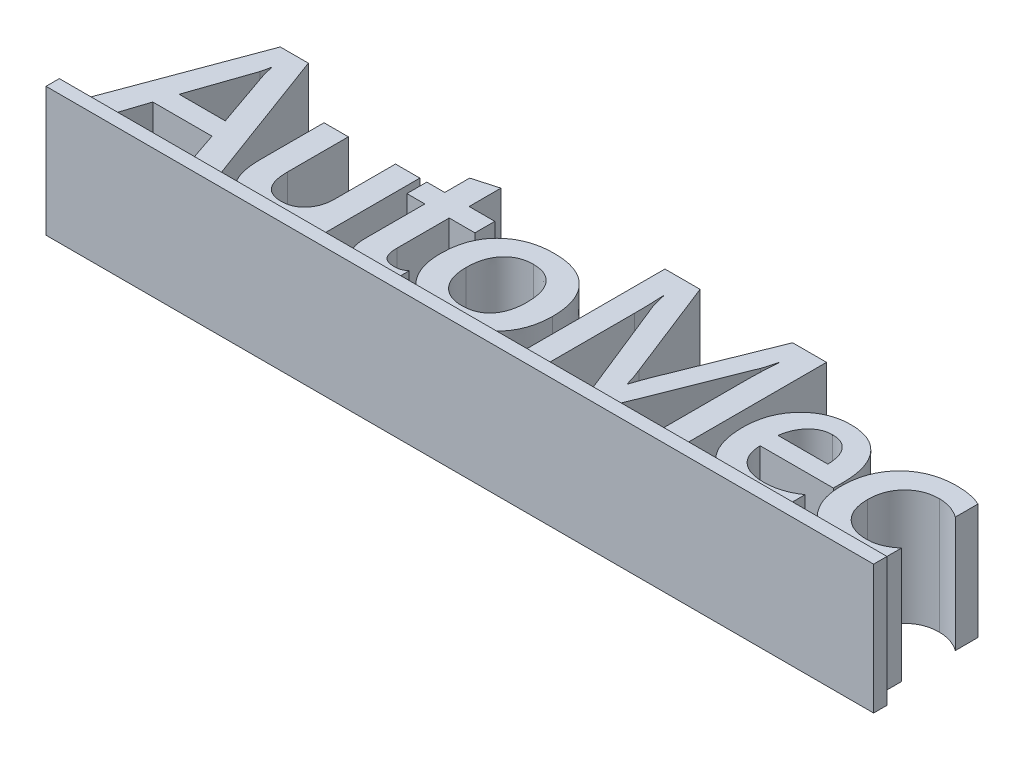
from build123d import *

# Parameters (mm, degrees)
BOSS_EXTRUDE3_DEPTH   = 26
BOSS_EXTRUDE3_2_DEPTH = 26
BOSS_EXTRUDE3_3_DEPTH = 26
BOSS_EXTRUDE3_4_DEPTH = 26
BOSS_EXTRUDE3_5_DEPTH = 26
BOSS_EXTRUDE3_6_DEPTH = 26
BOSS_EXTRUDE3_7_DEPTH = 26
SKETCH8_W             = 186.081167763
SKETCH8_H             = 3
BOSS_EXTRUDE6_DEPTH   = 29
SKETCH9_W             = 4.604295261
SKETCH9_H             = 4.075246711
BOSS_EXTRUDE7_DEPTH   = 26
SKETCH10_W            = 0.947185653
SKETCH10_H            = 0.391447368
BOSS_EXTRUDE8_DEPTH   = 26
SKETCH11_W            = 4.086731753
SKETCH11_H            = 1.558799342
BOSS_EXTRUDE9_DEPTH   = 26
SKETCH12_W            = 3.146388957
SKETCH12_H            = 1.300164474
BOSS_EXTRUDE10_DEPTH  = 26


with BuildPart() as part:
    # Sketch3 → Boss-Extrude3 (new body)
    with BuildSketch(Plane(origin=(0, 0, 0), x_dir=(1, 0, 0), z_dir=(0, 1, 0))):
        Polygon((33.965871711, 0), (27.807565789, 0), (24.766858553, 8.947368421), (11.457648026, 8.947368421), (8.535773026, 0), (2.3984375, 0), (15.071546053, 34), (21.390625, 34), align=None)
        with BuildLine():
            Line((23.277960526, 13.421052632), (18.587582237, 26.932976974))
            add(Edge.make_bspline(
                [(18.587582237, 26.932976974), (18.548101045, 27.060575153), (18.459275885, 27.347646749), (18.367014618, 27.839645061), (18.239400169, 28.423737496), (18.174856897, 28.850100474), (18.140213816, 29.078947368)],
                knots=[0, 0, 0, 0, 0.729984796, 1.642326725, 2.734537859, 4, 4, 4, 4], degree=3))
            Line((18.140213816, 29.078947368), (18.042351974, 29.078947368))
            add(Edge.make_bspline(
                [(18.042351974, 29.078947368), (18.009674078, 28.864165636), (17.947638546, 28.456425206), (17.825299172, 27.886844553), (17.710174952, 27.383968641), (17.617503708, 27.077025279), (17.574013158, 26.932976974)],
                knots=[0, 0, 0, 0, 1.185466323, 2.250482591, 3.1789527, 4, 4, 4, 4], degree=3))
            Line((17.574013158, 26.932976974), (12.925575658, 13.421052632))
            Line((12.925575658, 13.421052632), (23.277960526, 13.421052632))
        make_face(mode=Mode.SUBTRACT)
    extrude(amount=BOSS_EXTRUDE3_DEPTH)



with BuildPart() as body_2:
    # Sketch3 → Boss-Extrude3 2 (new body)
    with BuildSketch(Plane(origin=(0, 0, 0), x_dir=(1, 0, 0), z_dir=(0, 1, 0))):
        with BuildLine():
            Line((56.29375, 0), (50.820476974, 0))
            Line((50.820476974, 0), (50.820476974, 4.075246711))
            Line((50.820476974, 4.075246711), (50.722615132, 4.075246711))
            add(Edge.make_bspline(
                [(50.722615132, 4.075246711), (50.519935144, 3.715057326), (50.126604746, 3.016056721), (49.39560065, 2.091776269), (48.587459374, 1.308026839), (47.69578099, 0.659377738), (46.715132669, 0.162634197), (45.654651126, -0.197849774), (44.509830852, -0.409768991), (43.719402161, -0.434602531), (43.313075658, -0.447368421)],
                knots=[0, 0, 0, 0, 1.079725848, 2.095367192, 3.06949039, 4.016760712, 4.968041884, 5.93364341, 6.937772052, 8, 8, 8, 8], degree=3))
            add(Edge.make_bspline(
                [(43.313075658, -0.447368421), (42.967836418, -0.439355495), (42.296204328, -0.423767065), (41.323402019, -0.302248164), (40.411572364, -0.113138442), (39.573631593, 0.178861855), (38.794387817, 0.531364638), (38.090987822, 0.978782599), (37.447457228, 1.498940574), (36.873222706, 2.103701725), (36.3649034, 2.78825589), (35.932471092, 3.555200243), (35.568305349, 4.40217537), (35.27199471, 5.325304496), (35.030777604, 6.32693486), (34.868069359, 7.409734562), (34.770474627, 8.572757186), (34.757070793, 9.373567228), (34.750164474, 9.786184211)],
                knots=[0, 0, 0, 0, 1.084713073, 2.110212352, 3.076892847, 4.00554504, 4.893457195, 5.758981407, 6.617912711, 7.488102356, 8.372747002, 9.291062449, 10.248797554, 11.265446988, 12.334723834, 13.48333476, 14.703289464, 16, 16, 16, 16], degree=3))
            Line((34.750164474, 9.786184211), (34.750164474, 24.157894737))
            Line((34.750164474, 24.157894737), (40.2234375, 24.157894737))
            Line((40.2234375, 24.157894737), (40.2234375, 10.457236842))
            add(Edge.make_bspline(
                [(40.2234375, 10.457236842), (40.227921152, 10.198508998), (40.236656835, 9.694418861), (40.290824437, 8.963512292), (40.386108863, 8.283162461), (40.529108844, 7.655814879), (40.70017065, 7.074146206), (40.914933354, 6.540934251), (41.176398091, 6.062390631), (41.470789874, 5.633108204), (41.801388553, 5.247886169), (42.179550685, 4.920526462), (42.596762914, 4.64571346), (43.052420412, 4.41933377), (43.54412455, 4.239131733), (44.078642, 4.110713393), (44.651223063, 4.045456825), (45.046487399, 4.032807556), (45.249342105, 4.026315789)],
                knots=[0, 0, 0, 0, 1.33211556, 2.595415729, 3.771149648, 4.865479191, 5.905389678, 6.890066322, 7.81878141, 8.707263502, 9.566093683, 10.424923863, 11.273385492, 12.131796628, 13.038874263, 13.964173805, 14.955187992, 16, 16, 16, 16], degree=3))
            add(Edge.make_bspline(
                [(45.249342105, 4.026315789), (45.447702282, 4.031443284), (45.836939898, 4.04150485), (46.40863582, 4.128206474), (46.951484922, 4.267498611), (47.471948728, 4.456495826), (47.957649198, 4.709484046), (48.421276691, 5.013940546), (48.851224373, 5.379136943), (49.257586842, 5.791759516), (49.6275201, 6.247945191), (49.939226546, 6.750076446), (50.217875081, 7.277381295), (50.440348446, 7.842328422), (50.606200553, 8.445473657), (50.734490971, 9.077862697), (50.801381432, 9.747490403), (50.814013736, 10.203137507), (50.820476974, 10.436266447)],
                knots=[0, 0, 0, 0, 0.999150715, 1.960610493, 2.906092422, 3.819987555, 4.744233245, 5.659334442, 6.60947108, 7.580916613, 8.57481006, 9.561813227, 10.554388006, 11.576996797, 12.614063925, 13.703262757, 14.824889011, 16, 16, 16, 16], degree=3))
            Line((50.820476974, 10.436266447), (50.820476974, 24.157894737))
            Line((50.820476974, 24.157894737), (56.29375, 24.157894737))
            Line((56.29375, 24.157894737), (56.29375, 0))
        make_face()
    extrude(amount=BOSS_EXTRUDE3_2_DEPTH)


with BuildPart() as body_3:
    # Sketch3 → Boss-Extrude3 3 (new body)
    with BuildSketch(Plane(origin=(0, 0, 0), x_dir=(1, 0, 0), z_dir=(0, 1, 0))):
        with BuildLine():
            add(Edge.make_bspline(
                [(73.148355263, 0.391447368), (72.862441983, 0.262212261), (72.266015813, -0.007377176), (71.261962299, -0.266704273), (70.135503638, -0.415010239), (69.341561845, -0.436256328), (68.926315789, -0.447368421)],
                knots=[0, 0, 0, 0, 0.865864127, 1.80622609, 2.852616184, 4, 4, 4, 4], degree=3))
            add(Edge.make_bspline(
                [(68.926315789, -0.447368421), (68.641827941, -0.441976485), (68.090415955, -0.431525501), (67.292069444, -0.351932158), (66.545705264, -0.234353409), (65.859662174, -0.037245325), (65.219587354, 0.183975911), (64.642293108, 0.478393413), (64.112458994, 0.808620086), (63.648826887, 1.208441395), (63.231335916, 1.651644998), (62.867107897, 2.147747278), (62.563427287, 2.700673489), (62.324499579, 3.303888027), (62.120319749, 3.953780656), (61.997422062, 4.661163859), (61.908208741, 5.417414181), (61.89898653, 5.938985548), (61.894243421, 6.207236842)],
                knots=[0, 0, 0, 0, 1.229298507, 2.382702577, 3.465489837, 4.48920099, 5.464042504, 6.387321762, 7.284075982, 8.155768071, 9.025013382, 9.911301508, 10.808281896, 11.743349568, 12.711823935, 13.746816671, 14.84115697, 16, 16, 16, 16], degree=3))
            Line((61.894243421, 6.207236842), (61.894243421, 19.684210526))
            Line((61.894243421, 19.684210526), (57.8609375, 19.684210526))
            Line((57.8609375, 19.684210526), (57.8609375, 24.157894737))
            Line((57.8609375, 24.157894737), (61.894243421, 24.157894737))
            Line((61.894243421, 24.157894737), (61.894243421, 29.756990132))
            Line((61.894243421, 29.756990132), (67.367516447, 31.315789474))
            Line((67.367516447, 31.315789474), (67.367516447, 24.157894737))
            Line((67.367516447, 24.157894737), (73.148355263, 24.157894737))
            Line((73.148355263, 24.157894737), (73.148355263, 19.684210526))
            Line((73.148355263, 19.684210526), (67.367516447, 19.684210526))
            Line((67.367516447, 19.684210526), (67.367516447, 7.912828947))
            add(Edge.make_bspline(
                [(67.367516447, 7.912828947), (67.374850237, 7.588159983), (67.38844778, 6.986192822), (67.536911381, 6.155880793), (67.761211112, 5.461570538), (68.114551679, 4.907817754), (68.59659397, 4.495374962), (69.203704002, 4.218775229), (69.933362745, 4.051738768), (70.46080435, 4.035192189), (70.74375, 4.026315789)],
                knots=[0, 0, 0, 0, 1.301770834, 2.413607027, 3.375007823, 4.212960136, 5.015447376, 5.885665953, 6.865767099, 8, 8, 8, 8], degree=3))
            add(Edge.make_bspline(
                [(70.74375, 4.026315789), (70.968555945, 4.036632664), (71.410728871, 4.056925021), (72.046525735, 4.230108326), (72.636863761, 4.512975139), (72.975929682, 4.783488276), (73.148355263, 4.921052632)],
                knots=[0, 0, 0, 0, 1.027228491, 2.020465378, 2.993344995, 4, 4, 4, 4], degree=3))
            Line((73.148355263, 4.921052632), (73.148355263, 0.391447368))
        make_face()
    extrude(amount=BOSS_EXTRUDE3_3_DEPTH)


with BuildPart() as body_4:
    # Sketch3 → Boss-Extrude3 4 (new body)
    with BuildSketch(Plane(origin=(0, 0, 0), x_dir=(1, 0, 0), z_dir=(0, 1, 0))):
        with BuildLine():
            add(Edge.make_bspline(
                [(85.571217105, -0.447368421), (85.116478046, -0.435766328), (84.227645246, -0.413088881), (82.927962397, -0.261228177), (81.703137182, 0.006607153), (80.543264181, 0.367647312), (79.459612752, 0.848074703), (78.43559015, 1.417902524), (77.497499926, 2.114586968), (76.621934566, 2.891734964), (75.84104346, 3.765878229), (75.160560676, 4.713335834), (74.582280057, 5.727045524), (74.113024656, 6.810239741), (73.748142544, 7.962828332), (73.495555668, 9.183386916), (73.325787669, 10.468788131), (73.311066251, 11.349072795), (73.303536184, 11.799342105)],
                knots=[0, 0, 0, 0, 1.116215865, 2.181755126, 3.205970085, 4.189968188, 5.158030114, 6.110765013, 7.060249804, 8.020167771, 8.980085738, 9.930844381, 10.878605029, 11.839136188, 12.823134291, 13.840555896, 14.895435254, 16, 16, 16, 16], degree=3))
            add(Edge.make_bspline(
                [(73.303536184, 11.799342105), (73.314220878, 12.289102273), (73.3349896, 13.241089534), (73.497550388, 14.628486583), (73.768180659, 15.934853928), (74.150956738, 17.160258467), (74.644677732, 18.302630783), (75.238780326, 19.365546668), (75.949536427, 20.344261164), (76.770987302, 21.229681388), (77.676158327, 22.029509007), (78.671549074, 22.713633519), (79.729896897, 23.308764241), (80.871664382, 23.782724766), (82.086885278, 24.153351896), (83.378314, 24.418988882), (84.745069408, 24.570957708), (85.680354577, 24.593659861), (86.158388158, 24.605263158)],
                knots=[0, 0, 0, 0, 1.143863687, 2.223422261, 3.257839875, 4.256304326, 5.216870454, 6.160037922, 7.095256146, 8.035151121, 8.976274615, 9.910906598, 10.851416034, 11.807716392, 12.792557447, 13.815208396, 14.883331214, 16, 16, 16, 16], degree=3))
            add(Edge.make_bspline(
                [(86.158388158, 24.605263158), (86.617850734, 24.596854423), (87.51386906, 24.580456177), (88.817110317, 24.424602055), (90.043763445, 24.166945732), (91.191391663, 23.80429618), (92.263789352, 23.341556299), (93.255583369, 22.774535667), (94.164816844, 22.094660338), (94.993989506, 21.320657514), (95.739573195, 20.457633351), (96.386388525, 19.507505879), (96.929059131, 18.476183891), (97.383285084, 17.370823953), (97.719730179, 16.180360682), (97.973264602, 14.914277774), (98.119518448, 13.566617615), (98.137332542, 12.643167598), (98.146463816, 12.169819079)],
                knots=[0, 0, 0, 0, 1.124545113, 2.19302525, 3.207845701, 4.189328101, 5.13466569, 6.062314969, 6.979645247, 7.907995908, 8.834293529, 9.766265415, 10.71560516, 11.682808566, 12.686617748, 13.739403152, 14.841247334, 16, 16, 16, 16], degree=3))
            add(Edge.make_bspline(
                [(98.146463816, 12.169819079), (98.134726063, 11.703476106), (98.111830162, 10.793817996), (97.962429283, 9.462937389), (97.68370472, 8.209030284), (97.319143745, 7.018065326), (96.830010563, 5.904692311), (96.251686073, 4.850381801), (95.54722111, 3.88059887), (94.74874086, 2.983735841), (93.865108427, 2.172310538), (92.895434242, 1.470188283), (91.84968076, 0.880590266), (90.736809482, 0.388629433), (89.548338334, 0.010764151), (88.288078907, -0.251687484), (86.95492984, -0.415920265), (86.040046428, -0.436713162), (85.571217105, -0.447368421)],
                knots=[0, 0, 0, 0, 1.113330615, 2.17168539, 3.190677719, 4.175832019, 5.139908346, 6.08858641, 7.041023692, 7.994418744, 8.951134188, 9.899061883, 10.845617805, 11.811921879, 12.798754882, 13.816577622, 14.881111603, 16, 16, 16, 16], degree=3))
        make_face()
        with BuildLine():
            add(Edge.make_bspline(
                [(85.829851974, 20.131578947), (85.56863105, 20.12446461), (85.060594086, 20.110628252), (84.316663712, 20.014448035), (83.617780758, 19.836576065), (82.954687858, 19.601021464), (82.338688179, 19.291610514), (81.761972902, 18.916534488), (81.233343875, 18.466459657), (80.74347475, 17.958015842), (80.307788442, 17.387818344), (79.931851654, 16.762867498), (79.604959121, 16.088531164), (79.353646914, 15.356321889), (79.136041167, 14.581154127), (79.006106276, 13.748184142), (78.90787838, 12.868845838), (78.899786796, 12.263332003), (78.895641447, 11.953125)],
                knots=[0, 0, 0, 0, 1.034419223, 2.011795967, 2.962862038, 3.885162513, 4.792949386, 5.686082137, 6.602827649, 7.536002034, 8.47717027, 9.437677761, 10.419876795, 11.438371995, 12.499281577, 13.603559465, 14.772294546, 16, 16, 16, 16], degree=3))
            add(Edge.make_bspline(
                [(78.895641447, 11.953125), (78.900112184, 11.654609345), (78.908866125, 11.070099825), (79.003229628, 10.219925279), (79.146299088, 9.414402333), (79.358933782, 8.663434782), (79.612269348, 7.953429869), (79.948218619, 7.302372596), (80.328503158, 6.692053056), (80.772069432, 6.138709078), (81.261146454, 5.641541459), (81.793537214, 5.204828451), (82.370794677, 4.838271568), (82.990056547, 4.545819209), (83.643558484, 4.314421759), (84.335956296, 4.143741215), (85.069877085, 4.047647134), (85.57327703, 4.03351746), (85.829851974, 4.026315789)],
                knots=[0, 0, 0, 0, 1.204180082, 2.357848612, 3.447833994, 4.501816686, 5.504423492, 6.484239282, 7.452070217, 8.402198806, 9.339727465, 10.261995276, 11.175013197, 12.09189658, 13.019803471, 13.968535155, 14.964594688, 16, 16, 16, 16], degree=3))
            add(Edge.make_bspline(
                [(85.829851974, 4.026315789), (86.091136112, 4.0332465), (86.601606338, 4.046787014), (87.341343215, 4.145429359), (88.038202046, 4.305372325), (88.68352726, 4.536733819), (89.29164637, 4.822873501), (89.839907616, 5.191056991), (90.352354486, 5.611452283), (90.804031028, 6.10536083), (91.213969904, 6.654359265), (91.567848693, 7.26265404), (91.870815089, 7.924886931), (92.114452506, 8.641806516), (92.303011665, 9.413826936), (92.431415929, 10.241842607), (92.519111547, 11.124091472), (92.528538984, 11.731542985), (92.533388158, 12.043996711)],
                knots=[0, 0, 0, 0, 1.055638297, 2.062398134, 3.010235434, 3.939415019, 4.828014631, 5.718557739, 6.601050065, 7.500508731, 8.41574815, 9.365314357, 10.338626266, 11.354023461, 12.420524239, 13.545919019, 14.737698847, 16, 16, 16, 16], degree=3))
            add(Edge.make_bspline(
                [(92.533388158, 12.043996711), (92.528636186, 12.358787139), (92.519430925, 12.96858194), (92.430871287, 13.855394035), (92.303001585, 14.688072024), (92.114518838, 15.467118914), (91.870463031, 16.190722433), (91.569939733, 16.859013215), (91.211779342, 17.469346747), (90.804529745, 18.024709201), (90.352070854, 18.524479918), (89.842699556, 18.954359146), (89.287599579, 19.317701533), (88.687640215, 19.624782822), (88.037601211, 19.851324384), (87.341515764, 20.01280943), (86.601559616, 20.111014561), (86.091120294, 20.124616696), (85.829851974, 20.131578947)],
                knots=[0, 0, 0, 0, 1.265840082, 2.452116173, 3.581568067, 4.652248281, 5.671825925, 6.649173829, 7.594354862, 8.512905718, 9.415101245, 10.299547573, 11.18597808, 12.07877752, 13.003666078, 13.947126188, 14.949236727, 16, 16, 16, 16], degree=3))
        make_face(mode=Mode.SUBTRACT)
    extrude(amount=BOSS_EXTRUDE3_4_DEPTH)


with BuildPart() as body_5:
    # Sketch3 → Boss-Extrude3 5 (new body)
    with BuildSketch(Plane(origin=(0, 0, 0), x_dir=(1, 0, 0), z_dir=(0, 1, 0))):
        with BuildLine():
            Line((137.886759868, 0), (132.315625, 0))
            Line((132.315625, 0), (132.315625, 22.004934211))
            add(Edge.make_bspline(
                [(132.315625, 22.004934211), (132.320098386, 22.480322358), (132.329530975, 23.482726456), (132.397268758, 25.060477282), (132.501625531, 26.789691228), (132.599893243, 27.990984268), (132.651151316, 28.617598684)],
                knots=[0, 0, 0, 0, 0.861329844, 1.816201289, 2.860894294, 4, 4, 4, 4], degree=3))
            Line((132.651151316, 28.617598684), (132.553289474, 28.617598684))
            add(Edge.make_bspline(
                [(132.553289474, 28.617598684), (132.471546843, 28.272188762), (132.319765614, 27.630825231), (132.079720357, 26.753580215), (131.872815336, 26.02576574), (131.710066849, 25.603974847), (131.637582237, 25.416118421)],
                knots=[0, 0, 0, 0, 1.277912959, 2.372852416, 3.275304104, 4, 4, 4, 4], degree=3))
            Line((131.637582237, 25.416118421), (121.536842105, 0))
            Line((121.536842105, 0), (117.671299342, 0))
            Line((117.671299342, 0), (107.549588816, 25.227384868))
            add(Edge.make_bspline(
                [(107.549588816, 25.227384868), (107.475205943, 25.436387568), (107.310552917, 25.899033408), (107.092391938, 26.674672477), (106.870621411, 27.596997667), (106.725739026, 28.260794557), (106.647861842, 28.617598684)],
                knots=[0, 0, 0, 0, 0.758036603, 1.677980622, 2.751868064, 4, 4, 4, 4], degree=3))
            Line((106.647861842, 28.617598684), (106.556990132, 28.617598684))
            add(Edge.make_bspline(
                [(106.556990132, 28.617598684), (106.571083121, 28.433538974), (106.601220846, 28.039929034), (106.647037951, 27.408870305), (106.668534028, 26.697611031), (106.700012677, 25.905607709), (106.71996412, 25.031733652), (106.731025131, 24.076340829), (106.749844852, 23.041863072), (106.747129793, 22.326489768), (106.745723684, 21.956003289)],
                knots=[0, 0, 0, 0, 0.664632124, 1.421309473, 2.277635459, 3.226175416, 4.275090468, 5.42449288, 6.666164143, 8, 8, 8, 8], degree=3))
            Line((106.745723684, 21.956003289), (106.745723684, 0))
            Line((106.745723684, 0), (101.552055921, 0))
            Line((101.552055921, 0), (101.552055921, 34))
            Line((101.552055921, 34), (109.457894737, 34))
            Line((109.457894737, 34), (118.349342105, 11.351973684))
            add(Edge.make_bspline(
                [(118.349342105, 11.351973684), (118.507947926, 10.945134209), (118.801206879, 10.192896251), (119.172742356, 9.135776724), (119.465007682, 8.24973988), (119.607434406, 7.70609495), (119.670476974, 7.465460526)],
                knots=[0, 0, 0, 0, 1.275569132, 2.358501517, 3.273420907, 4, 4, 4, 4], degree=3))
            Line((119.670476974, 7.465460526), (119.789309211, 7.465460526))
            add(Edge.make_bspline(
                [(119.789309211, 7.465460526), (119.929001721, 7.882571238), (120.189904911, 8.661607389), (120.554953595, 9.746341283), (120.890181668, 10.657029259), (121.109368655, 11.203271224), (121.208305921, 11.449835526)],
                knots=[0, 0, 0, 0, 1.247784235, 2.330482053, 3.246408086, 4, 4, 4, 4], degree=3))
            Line((121.208305921, 11.449835526), (130.267516447, 34))
            Line((130.267516447, 34), (137.886759868, 34))
            Line((137.886759868, 34), (137.886759868, 0))
        make_face()
    extrude(amount=BOSS_EXTRUDE3_5_DEPTH)


with BuildPart() as body_6:
    # Sketch3 → Boss-Extrude3 6 (new body)
    with BuildSketch(Plane(origin=(0, 0, 0), x_dir=(1, 0, 0), z_dir=(0, 1, 0))):
        with BuildLine():
            Line((163.136513158, 10.289473684), (146.667763158, 10.289473684))
            add(Edge.make_bspline(
                [(146.667763158, 10.289473684), (146.681916181, 10.028076657), (146.709456716, 9.519421066), (146.82457735, 8.780817989), (146.987426476, 8.085979663), (147.221959693, 7.438636716), (147.507436238, 6.835556476), (147.850596895, 6.276598474), (148.262318088, 5.772566586), (148.721150037, 5.30722361), (149.24356479, 4.905416757), (149.804216141, 4.543742317), (150.416916975, 4.243128289), (151.075544659, 3.999833164), (151.779712564, 3.809549685), (152.528874831, 3.681758314), (153.322599989, 3.593167668), (153.867339054, 3.58377364), (154.147203947, 3.578947368)],
                knots=[0, 0, 0, 0, 1.106030723, 2.15223837, 3.155652007, 4.118403009, 5.056861912, 5.97255771, 6.88325983, 7.802656706, 8.728783019, 9.663304893, 10.619229044, 11.607246608, 12.627536803, 13.697993342, 14.817322111, 16, 16, 16, 16], degree=3))
            add(Edge.make_bspline(
                [(154.147203947, 3.578947368), (154.466706308, 3.585557866), (155.100457264, 3.598670161), (156.039986773, 3.706873928), (156.960477562, 3.882235416), (157.861088714, 4.125163615), (158.741146444, 4.443758804), (159.601115516, 4.828604288), (160.444068216, 5.281912603), (160.979187998, 5.636756391), (161.249177632, 5.815789474)],
                knots=[0, 0, 0, 0, 1.013618622, 2.010569713, 2.996631466, 3.984908343, 4.967192919, 5.963403465, 6.972454449, 8, 8, 8, 8], degree=3))
            Line((161.249177632, 5.815789474), (161.249177632, 1.558799342))
            add(Edge.make_bspline(
                [(161.249177632, 1.558799342), (160.964955256, 1.39813456), (160.387335665, 1.071618658), (159.459973022, 0.658955528), (158.462423321, 0.317655431), (157.398017678, 0.042623824), (156.271877804, -0.185621493), (155.07751493, -0.331546657), (153.820542132, -0.436425417), (152.9591191, -0.443665259), (152.518503289, -0.447368421)],
                knots=[0, 0, 0, 0, 0.863798221, 1.755480275, 2.681888941, 3.651212078, 4.66354657, 5.72070578, 6.834146486, 8, 8, 8, 8], degree=3))
            add(Edge.make_bspline(
                [(152.518503289, -0.447368421), (152.08464119, -0.439027879), (151.239653552, -0.422783883), (150.008418111, -0.265967549), (148.850169404, -0.007662782), (147.762341036, 0.34747033), (146.745947847, 0.803980288), (145.802374529, 1.36631826), (144.933474378, 2.03620246), (144.13137219, 2.796111076), (143.42880359, 3.661191392), (142.805941331, 4.605060083), (142.283789974, 5.635347007), (141.854754571, 6.747608084), (141.52962547, 7.943012815), (141.292624468, 9.216856054), (141.152399066, 10.575268955), (141.134043689, 11.507752474), (141.124588816, 11.988075658)],
                knots=[0, 0, 0, 0, 1.087572249, 2.118150232, 3.10619197, 4.059626329, 4.982768997, 5.894655562, 6.807384137, 7.728972193, 8.658913266, 9.595621626, 10.559880293, 11.549492996, 12.580070979, 13.661899038, 14.795641878, 16, 16, 16, 16], degree=3))
            add(Edge.make_bspline(
                [(141.124588816, 11.988075658), (141.132211118, 12.442992054), (141.147154583, 13.334852172), (141.316693161, 14.638817518), (141.569070539, 15.880291664), (141.935207523, 17.055548821), (142.404607302, 18.166120246), (142.981165023, 19.212890837), (143.660463535, 20.196374763), (144.444198684, 21.099532323), (145.296382497, 21.921130124), (146.21235488, 22.639659199), (147.176717207, 23.252576004), (148.199812675, 23.742433396), (149.267699635, 24.128408599), (150.383573375, 24.411354895), (151.553805064, 24.572366036), (152.350254926, 24.594157221), (152.756167763, 24.605263158)],
                knots=[0, 0, 0, 0, 1.135653552, 2.22644011, 3.278867653, 4.296855619, 5.295696662, 6.285544172, 7.276827928, 8.275516351, 9.267551598, 10.229262963, 11.178727018, 12.115837927, 13.056628604, 14.010861362, 14.986230084, 16, 16, 16, 16], degree=3))
            add(Edge.make_bspline(
                [(152.756167763, 24.605263158), (153.157493489, 24.59711202), (153.939966139, 24.581219587), (155.079531024, 24.421259961), (156.150795973, 24.174110453), (157.153654084, 23.823769222), (158.083786241, 23.367085319), (158.940991083, 22.803301323), (159.729017914, 22.141573402), (160.443880918, 21.383471573), (161.078566619, 20.535412052), (161.635070826, 19.609361673), (162.094605187, 18.598501658), (162.48223069, 17.514925773), (162.769319962, 16.347257288), (162.988917343, 15.107960076), (163.113561906, 13.787096413), (163.128716883, 12.880737768), (163.136513158, 12.414473684)],
                knots=[0, 0, 0, 0, 1.060061123, 2.066821994, 3.034733218, 3.961800763, 4.867871318, 5.766271274, 6.666695035, 7.581491725, 8.513821064, 9.461140289, 10.431008473, 11.443815559, 12.498263347, 13.60482883, 14.767836224, 16, 16, 16, 16], degree=3))
            Line((163.136513158, 12.414473684), (163.136513158, 10.289473684))
        make_face()
        with BuildLine():
            add(Edge.make_bspline(
                [(157.851973684, 14.315789474), (157.845936804, 14.555973572), (157.83418888, 15.02337801), (157.762305348, 15.705215489), (157.653970215, 16.346103073), (157.497926401, 16.946457546), (157.306059928, 17.505015629), (157.064256526, 18.021051624), (156.786096988, 18.498125873), (156.464496553, 18.931332217), (156.106789065, 19.319309477), (155.713164693, 19.654290274), (155.292408205, 19.946685468), (154.831965344, 20.176388998), (154.342857716, 20.359978603), (153.818926767, 20.48378942), (153.264176165, 20.562598117), (152.882269397, 20.573402382), (152.686266447, 20.578947368)],
                knots=[0, 0, 0, 0, 1.256878361, 2.445917645, 3.584559181, 4.655160571, 5.688664047, 6.670601375, 7.632575901, 8.573927598, 9.48852222, 10.387871166, 11.273979586, 12.162852259, 13.073373669, 14.002003812, 14.974584434, 16, 16, 16, 16], degree=3))
            add(Edge.make_bspline(
                [(152.686266447, 20.578947368), (152.492703819, 20.572842206), (152.111037736, 20.560804068), (151.549228177, 20.487506177), (151.015055632, 20.341873514), (150.499975017, 20.155464341), (150.010656463, 19.906579932), (149.535663383, 19.61330201), (149.09158058, 19.254763794), (148.53023715, 18.71046978), (147.903082096, 17.928296084), (147.326130519, 16.842281247), (146.886401227, 15.630755301), (146.742325768, 14.764235094), (146.667763158, 14.315789474)],
                knots=[0, 0, 0, 0, 0.731412914, 1.442197307, 2.133923827, 2.819010339, 3.507874879, 4.203900133, 4.924212601, 5.65874366, 7.155728722, 8.687831018, 10.285870704, 12, 12, 12, 12], degree=3))
            Line((146.667763158, 14.315789474), (157.851973684, 14.315789474))
        make_face(mode=Mode.SUBTRACT)
    extrude(amount=BOSS_EXTRUDE3_6_DEPTH)


with BuildPart() as body_7:
    # Sketch3 → Boss-Extrude3 7 (new body)
    with BuildSketch(Plane(origin=(0, 0, 0), x_dir=(1, 0, 0), z_dir=(0, 1, 0))):
        with BuildLine():
            add(Edge.make_bspline(
                [(182.479605263, 1.300164474), (182.235077982, 1.157932353), (181.745160946, 0.872966443), (180.961224669, 0.529444362), (180.150793942, 0.224313618), (179.303043288, -0.015137928), (178.427259627, -0.217523425), (177.514727748, -0.343197772), (176.572384923, -0.432491078), (175.932404336, -0.442367043), (175.608305921, -0.447368421)],
                knots=[0, 0, 0, 0, 0.945180728, 1.893695211, 2.857572795, 3.838956715, 4.836992861, 5.86061151, 6.916572732, 8, 8, 8, 8], degree=3))
            add(Edge.make_bspline(
                [(175.608305921, -0.447368421), (175.169672281, -0.439843233), (174.312573935, -0.425138875), (173.061973206, -0.255526799), (171.874070575, -0.001957245), (170.749845006, 0.363644593), (169.688937253, 0.831007419), (168.698923926, 1.410872962), (167.766446908, 2.084199857), (166.913415282, 2.867124872), (166.138976419, 3.726113541), (165.472576111, 4.661464357), (164.889161398, 5.64720509), (164.436820398, 6.708581475), (164.061284371, 7.820898265), (163.821983368, 9.002532686), (163.649266011, 10.240126744), (163.63465791, 11.088035644), (163.627220395, 11.519736842)],
                knots=[0, 0, 0, 0, 1.104432089, 2.158080981, 3.173706692, 4.161359349, 5.131159163, 6.088710264, 7.046891008, 8.023472411, 9.000477204, 9.955216849, 10.91276795, 11.880201679, 12.856694853, 13.865340236, 14.91316723, 16, 16, 16, 16], degree=3))
            add(Edge.make_bspline(
                [(163.627220395, 11.519736842), (163.63720478, 12.000294702), (163.656752617, 12.941150444), (163.831911067, 14.315388508), (164.095858747, 15.621886134), (164.492652398, 16.849080827), (164.989518468, 18.009119953), (165.607446658, 19.091881164), (166.329972398, 20.107044987), (167.163716129, 21.033455725), (168.08307623, 21.874227369), (169.091356597, 22.603592357), (170.170182184, 23.231811267), (171.331253783, 23.733118271), (172.560595417, 24.126097303), (173.864516244, 24.404681129), (175.242628462, 24.574754618), (176.18798928, 24.594949292), (176.670805921, 24.605263158)],
                knots=[0, 0, 0, 0, 1.106281174, 2.165922318, 3.185750223, 4.171754294, 5.130753209, 6.087226461, 7.037295562, 7.994987376, 8.952288216, 9.90114414, 10.855628253, 11.821687745, 12.807691816, 13.823388784, 14.888356597, 16, 16, 16, 16], degree=3))
            add(Edge.make_bspline(
                [(176.670805921, 24.605263158), (177.207609019, 24.593517547), (178.250917027, 24.570689271), (179.765751857, 24.345234749), (181.188314302, 23.996482305), (182.068777965, 23.626398239), (182.500575658, 23.444901316)],
                knots=[0, 0, 0, 0, 1.074814882, 2.08896517, 3.062788772, 4, 4, 4, 4], degree=3))
            Line((182.500575658, 23.444901316), (182.500575658, 18.342105263))
            add(Edge.make_bspline(
                [(182.500575658, 18.342105263), (182.290478549, 18.484958611), (181.876686012, 18.766312549), (181.229405181, 19.131024233), (180.570811335, 19.440402385), (179.899566606, 19.691626799), (179.219600689, 19.888667788), (178.530127704, 20.028947899), (177.828738554, 20.11574989), (177.356086412, 20.126279041), (177.118174342, 20.131578947)],
                knots=[0, 0, 0, 0, 1.05726283, 2.08231075, 3.089021343, 4.083508416, 5.062789754, 6.032949626, 7.009874318, 8, 8, 8, 8], degree=3))
            add(Edge.make_bspline(
                [(177.118174342, 20.131578947), (176.835960962, 20.124864448), (176.281175933, 20.111664848), (175.467743291, 20.007807742), (174.697140562, 19.822401692), (173.961260851, 19.580090054), (173.26875144, 19.255927357), (172.611186323, 18.861949232), (171.999049515, 18.390840787), (171.422623476, 17.862031341), (170.91073705, 17.266964158), (170.450539865, 16.632993523), (170.075240802, 15.946261746), (169.753396399, 15.224501739), (169.520588038, 14.447949531), (169.345798656, 13.632431853), (169.238049315, 12.771492339), (169.225668053, 12.184113126), (169.219325658, 11.883223684)],
                knots=[0, 0, 0, 0, 1.055538032, 2.07501394, 3.060193738, 4.016615223, 4.96809928, 5.914299052, 6.878315699, 7.852795973, 8.835079823, 9.809793944, 10.777428812, 11.757118377, 12.760634359, 13.803428427, 14.874789608, 16, 16, 16, 16], degree=3))
            add(Edge.make_bspline(
                [(169.219325658, 11.883223684), (169.226110191, 11.586996663), (169.239343792, 11.009189802), (169.340102993, 10.167823254), (169.495428507, 9.372526271), (169.733615635, 8.629733612), (170.010411215, 7.923461357), (170.38530356, 7.280526414), (170.801336029, 6.671528843), (171.293544796, 6.121612518), (171.836131327, 5.626388637), (172.427435205, 5.193712226), (173.070306896, 4.840514966), (173.748168343, 4.53558346), (174.475088032, 4.303916063), (175.246393042, 4.147261776), (176.062344286, 4.04630028), (176.621565242, 4.033092147), (176.908470395, 4.026315789)],
                knots=[0, 0, 0, 0, 1.143353521, 2.230173021, 3.267542959, 4.266240449, 5.238496168, 6.189162683, 7.132480114, 8.081996758, 9.030831338, 9.964707814, 10.903122628, 11.857612043, 12.830574993, 13.841514051, 14.892600977, 16, 16, 16, 16], degree=3))
            add(Edge.make_bspline(
                [(176.908470395, 4.026315789), (177.153513106, 4.032905261), (177.64119172, 4.046019482), (178.366753458, 4.156037511), (179.080958924, 4.329631336), (179.7846826, 4.577665903), (180.478977795, 4.894169159), (181.164083556, 5.279751112), (181.838709821, 5.734308184), (182.263385142, 6.084738856), (182.479605263, 6.263157895)],
                knots=[0, 0, 0, 0, 0.958362683, 1.907312336, 2.864763925, 3.830685642, 4.82212851, 5.846678698, 6.903653287, 8, 8, 8, 8], degree=3))
            Line((182.479605263, 6.263157895), (182.479605263, 1.300164474))
        make_face()
    extrude(amount=BOSS_EXTRUDE3_7_DEPTH)


with BuildPart() as part_1:
    add(part.part)

    add(body_2.part)  # Boss-Extrude6 merges body 2

    add(body_3.part)  # Boss-Extrude6 merges body 3

    add(body_4.part)  # Boss-Extrude6 merges body 4

    add(body_5.part)  # Boss-Extrude6 merges body 5

    add(body_6.part)  # Boss-Extrude6 merges body 6

    add(body_7.part)  # Boss-Extrude6 merges body 7
    # Sketch8 → Boss-Extrude6 (add)
    with BuildSketch(Plane(origin=(0, 0, 0), x_dir=(1, 0, 0), z_dir=(0, 1, 0))):
        with Locations((92.439021382, -1.5)):
            Rectangle(SKETCH8_W, SKETCH8_H)
    extrude(amount=BOSS_EXTRUDE6_DEPTH)

    # Sketch9 → Boss-Extrude7 (add)
    with BuildSketch(Plane(origin=(0, 0, 0), x_dir=(1, 0, 0), z_dir=(0, 1, 0))):
        with Locations((48.518329343, 2.037623356)):
            Rectangle(SKETCH9_W, SKETCH9_H)
    extrude(amount=BOSS_EXTRUDE7_DEPTH)

    # Sketch10 → Boss-Extrude8 (add)
    with BuildSketch(Plane(origin=(0, 0, 0), x_dir=(1, 0, 0), z_dir=(0, 1, 0))):
        with Locations((72.674762437, 0.195723684)):
            Rectangle(SKETCH10_W, SKETCH10_H)
    extrude(amount=BOSS_EXTRUDE8_DEPTH)

    # Sketch11 → Boss-Extrude9 (add)
    with BuildSketch(Plane(origin=(0, 0, 0), x_dir=(1, 0, 0), z_dir=(0, 1, 0))):
        with Locations((159.205811756, 0.779399671)):
            Rectangle(SKETCH11_W, SKETCH11_H)
    extrude(amount=BOSS_EXTRUDE9_DEPTH)

    # Sketch12 → Boss-Extrude10 (add)
    with BuildSketch(Plane(origin=(0, 0, 0), x_dir=(1, 0, 0), z_dir=(0, 1, 0))):
        with Locations((180.906410784, 0.650082237)):
            Rectangle(SKETCH12_W, SKETCH12_H)
    extrude(amount=BOSS_EXTRUDE10_DEPTH)


solid = part_1.part
